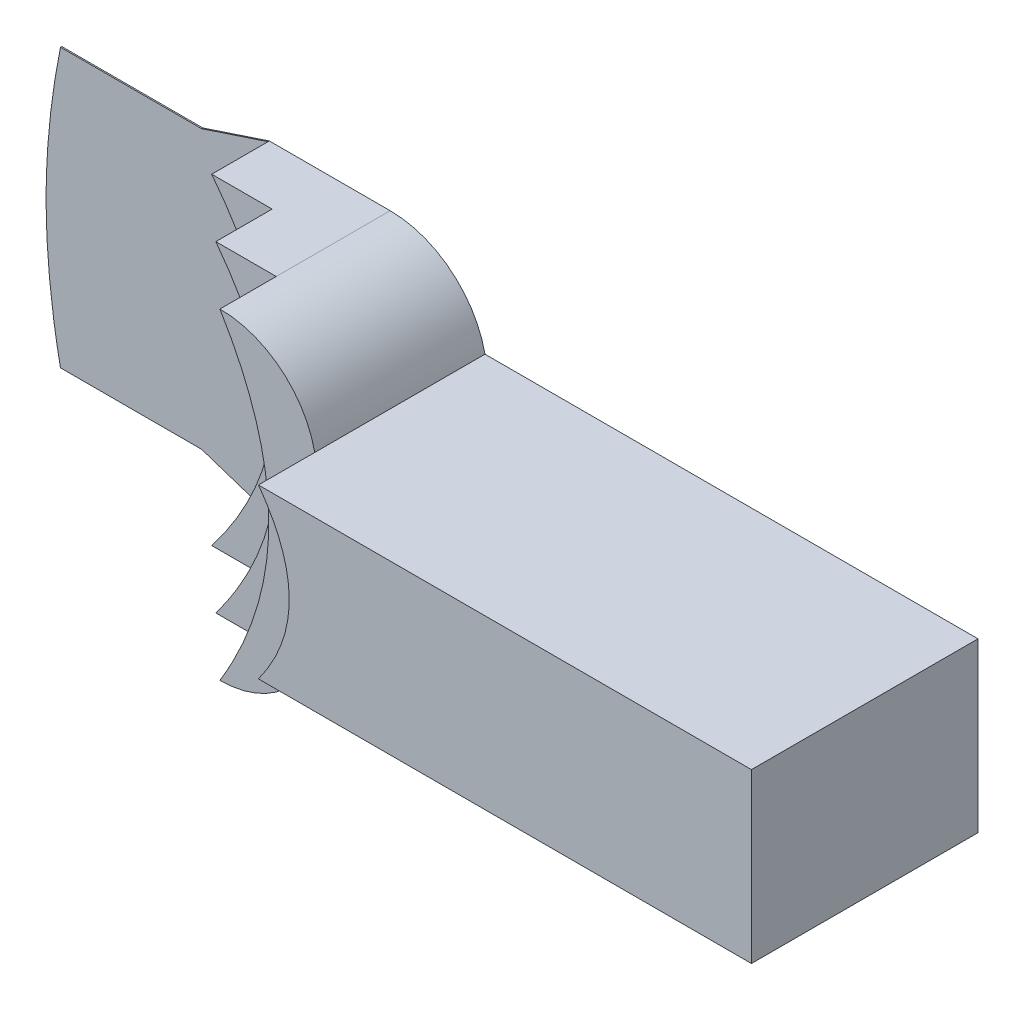
from build123d import *

# Parameters (mm, degrees)
BOSS_EXTRU_2_DEPTH       = 1408
ENL_V_START              = 1058
ENL_V_MAT_EXTRU_9_DEPTH  = 350
ENL_V_MAT_EXTRU_10_DEPTH = 350
ENL_V_MAT_EXTRU_11_DEPTH = 350
ENL_V_MAT_EXTRU_12_DEPTH = 350


with BuildPart() as part:
    # Esquisse2 → Boss.-Extru.2 (new body)
    with BuildSketch(Plane.XY):
        with BuildLine():
            Line((2720.163515451, 521.837758863), (5784.163515451, 521.837758863))
            Line((5784.163515451, 521.837758863), (5784.163515451, -521.837758863))
            Line((5784.163515451, -521.837758863), (2720.163515451, -521.837758863))
            ThreePointArc((2720.163515451, -521.837758863), (2510.100903564, -864.987952329), (2130.858380196, -999.35113426))
            Line((2130.858380196, -999.35113426), (1379.952136984, -999.35113426))
            Line((1379.952136984, -999.35113426), (966.87581893, -862.850763473))
            Line((966.87581893, -862.850763473), (89.994512184, -862.850763473))
            add(Edge.make_bspline(
                [(89.994512184, -862.850763473), (1.98722085, -431.524414356), (0, 0)],
                knots=[0, 0, 0, 0.488709908, 0.488709908, 0.488709908], degree=2))
            add(Edge.make_bspline(
                [(89.994512184, 862.850763473), (1.98722085, 431.524414356), (0, 0)],
                knots=[0, 0, 0, 0.488709908, 0.488709908, 0.488709908], degree=2))
            Line((89.994512184, 862.850763473), (966.87581893, 862.850763473))
            Line((966.87581893, 862.850763473), (1379.952136984, 999.35113426))
            Line((1379.952136984, 999.35113426), (2130.858380196, 999.35113426))
            ThreePointArc((2130.858380196, 999.35113426), (2510.100903564, 864.987952329), (2720.163515451, 521.837758863))
        make_face()
    extrude(amount=BOSS_EXTRU_2_DEPTH)

    # Esquisse3 → Enlèv. mat.-Extru.9 (cut)
    with BuildSketch(Plane.XY.offset(ENL_V_START)):
        with BuildLine():
            Line((1379.952136984, 999.351134268), (2130.858380196, 999.351134268))
            ThreePointArc((2130.858380196, 999.351134268), (2510.100903563, 864.987952337), (2720.163515451, 521.837758871))
            add(Edge.make_bspline(
                [(2720.163515451, 521.837758871), (3102.628436134, 8e-09), (2720.163515451, -521.837758855)],
                knots=[0, 0, 0, 1, 1, 1], degree=2))
            ThreePointArc((2720.163515451, -521.837758855), (2510.100903563, -864.987952321), (2130.858380196, -999.351134252))
            Line((2130.858380196, -999.351134252), (1379.952136984, -999.351134252))
            Line((1379.952136984, -999.351134252), (966.87581893, -862.850763465))
            Line((966.87581893, -862.850763465), (89.994512183, -862.850763465))
            add(Edge.make_bspline(
                [(89.994512183, -862.850763465), (1.98722085, -431.524414347), (0, 8e-09)],
                knots=[0, 0, 0, 0.488709908, 0.488709908, 0.488709908], degree=2))
            add(Edge.make_bspline(
                [(89.994512183, 862.850763482), (1.98722085, 431.524414364), (0, 8e-09)],
                knots=[0, 0, 0, 0.488709908, 0.488709908, 0.488709908], degree=2))
            Line((89.994512183, 862.850763482), (966.87581893, 862.850763482))
            Line((966.87581893, 862.850763482), (1379.952136984, 999.351134268))
        make_face()
    extrude(amount=ENL_V_MAT_EXTRU_9_DEPTH, mode=Mode.SUBTRACT)

    # Esquisse9 → Enlèv. mat.-Extru.10 (cut)
    with BuildSketch(Plane.XY.offset(1058)):
        with BuildLine():
            add(Edge.make_bspline(
                [(2130.858380196, 999.35113426), (2738.483910579, 0), (2130.858380196, -999.35113426)],
                knots=[0, 0, 0, 1, 1, 1], degree=2))
            Line((2130.858380196, -999.35113426), (1379.952136984, -999.351134252))
            Line((1379.952136984, -999.351134252), (966.87581893, -862.850763465))
            Line((966.87581893, -862.850763465), (89.994512183, -862.850763465))
            add(Edge.make_bspline(
                [(0, 8e-09), (1.98722085, -431.524414347), (89.994512183, -862.850763465)],
                knots=[0, 0, 0, 1, 1, 1], degree=2))
            add(Edge.make_bspline(
                [(89.994512183, 862.850763482), (1.98722085, 431.524414364), (0, 8e-09)],
                knots=[0, 0, 0, 1, 1, 1], degree=2))
            Line((89.994512183, 862.850763482), (966.87581893, 862.850763482))
            Line((966.87581893, 862.850763482), (1379.952136984, 999.351134268))
            Line((1379.952136984, 999.351134268), (2130.858380196, 999.35113426))
        make_face()
    extrude(amount=-ENL_V_MAT_EXTRU_10_DEPTH, mode=Mode.SUBTRACT)

    # Esquisse10 → Enlèv. mat.-Extru.11 (cut)
    with BuildSketch(Plane.XY.offset(708)):
        with BuildLine():
            Line((1755.405258589, 999.351134268), (1379.952136984, 999.351134268))
            Line((1379.952136984, 999.351134268), (966.87581893, 862.850763473))
            Line((966.87581893, 862.850763473), (89.994512184, 862.850763473))
            add(Edge.make_bspline(
                [(89.994512184, 862.850763473), (1.98722085, 431.524414356), (0, 0)],
                knots=[0, 0, 0, 0.488709908, 0.488709908, 0.488709908], degree=2))
            add(Edge.make_bspline(
                [(89.994512184, -862.850763473), (1.98722085, -431.524414356), (0, 0)],
                knots=[0, 0, 0, 0.488709908, 0.488709908, 0.488709908], degree=2))
            Line((89.994512184, -862.850763473), (966.87581893, -862.850763473))
            Line((966.87581893, -862.850763473), (1379.952136984, -999.35113426))
            Line((1379.952136984, -999.35113426), (1755.40525859, -999.35113426))
            add(Edge.make_bspline(
                [(1755.405258589, 999.351134268), (2506.311501802, 3e-09), (1755.40525859, -999.35113426)],
                knots=[0, 0, 0, 1, 1, 1], degree=2))
        make_face()
    extrude(amount=-ENL_V_MAT_EXTRU_11_DEPTH, mode=Mode.SUBTRACT)

    # Esquisse11 → Enlèv. mat.-Extru.12 (cut)
    with BuildSketch(Plane.XY.offset(358)):
        with BuildLine():
            Line((966.87581893, -862.850763465), (89.994512183, -862.850763465))
            add(Edge.make_bspline(
                [(89.994512183, -862.850763465), (-89.994512183, 8e-09), (89.994512183, 862.850763482)],
                knots=[0, 0, 0, 1, 1, 1], degree=2))
            Line((89.994512183, 862.850763482), (966.87581893, 862.850763482))
            Line((966.87581893, 862.850763482), (1379.952136984, 999.351134268))
            add(Edge.make_bspline(
                [(1379.952136984, 999.351134268), (2157.533266673, 6e-09), (1379.952136984, -999.351134252)],
                knots=[0, 0, 0, 1, 1, 1], degree=2))
            Line((1379.952136984, -999.351134252), (966.87581893, -862.850763465))
        make_face()
    extrude(amount=-ENL_V_MAT_EXTRU_12_DEPTH, mode=Mode.SUBTRACT)


solid = part.part
